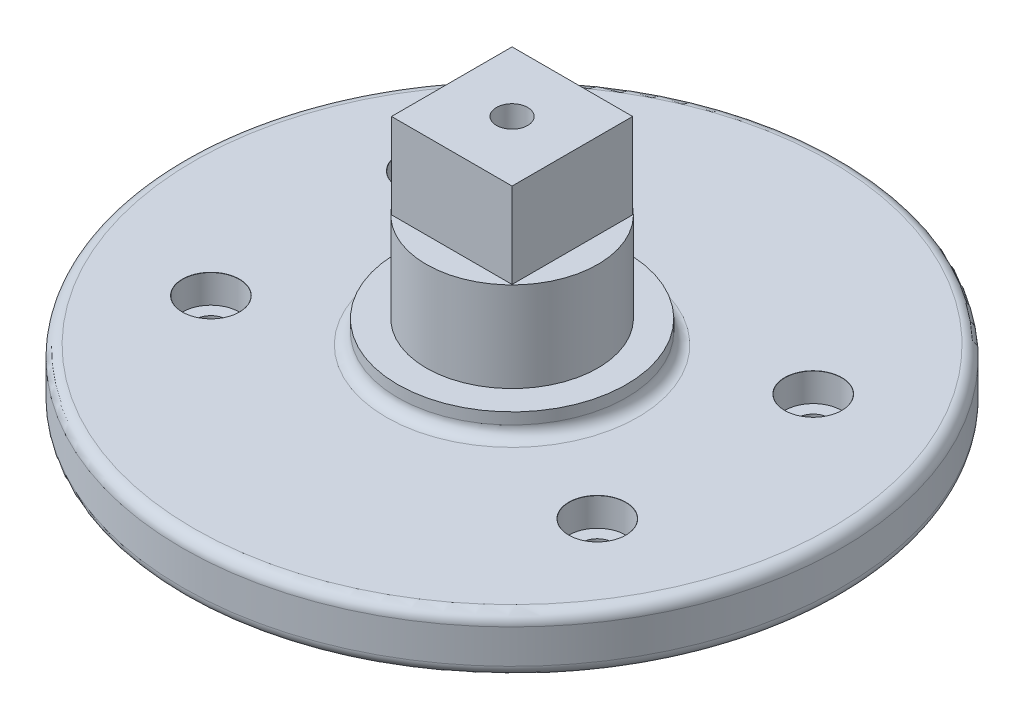
from build123d import *

# Parameters (mm, degrees)
SKETCH1_R                      = 58
BOSS_EXTRUDE1_DEPTH            = 10
CBORE_FOR_M5_SHCS3_AT_2_COUNT  = 2
CBORE_FOR_M5_SHCS3_AT_2_PITCH  = 68
CBORE_FOR_M5_SHCS3_AT_3_COUNT  = 2
CBORE_FOR_M5_SHCS3_AT_3_PITCH  = 38
CBORE_FOR_M5_SHCS3_AT_4_COUNT  = 2
CBORE_FOR_M5_SHCS3_AT_4_PITCH  = 77.897368377
SKETCH5_R                      = 20.125
BOSS_EXTRUDE3_DEPTH            = 4
SKETCH4_R                      = 15.1
BOSS_EXTRUDE2_DEPTH            = 15.8
FILLET1_R                      = 2
FILLET2_R                      = 2
SKETCH7_W                      = 21.213203436
SKETCH7_H                      = 21.213203436
BOSS_EXTRUDE4_DEPTH            = 15
M5_CLEARANCE_HOLE1_D           = 5.5
M5_CLEARANCE_HOLE1_CSINK_D     = 5.55
M5_CLEARANCE_HOLE1_CSINK_ANGLE = 90
CUT_EXTRUDE1_DEPTH             = 3.8


with BuildPart() as part:
    # Sketch1 → Boss-Extrude1 (new body)
    with BuildSketch(Plane(origin=(0, 0, 0), x_dir=(1, 0, 0), z_dir=(0, 1, 0))):
        with Locations(Location((0, 0, 0), (0, 0, 270))):
            Circle(SKETCH1_R)
    extrude(amount=BOSS_EXTRUDE1_DEPTH)

    # Sketch3 → CBORE for M5 SHCS3 (revolve, cut)
    with BuildSketch(Plane(origin=(-34, 10, -19), x_dir=(0, 0, 1), z_dir=(1, 0, 0))):
        Polygon((0, 0), (0, 10), (2.75, 10), (2.75, 5), (5, 5), (5, 0.025), (5.025, 0), align=None)
    cbore_for_m5_shcs3 = revolve(axis=Axis((-34, 16.35, -19), (0, -1, 0)), mode=Mode.SUBTRACT)

    # CBORE for M5 SHCS3 at 2: CBORE for M5 SHCS3 ×2
    with Locations(*[(i * CBORE_FOR_M5_SHCS3_AT_2_PITCH, 0, 0) for i in range(1, CBORE_FOR_M5_SHCS3_AT_2_COUNT)]):
        add(cbore_for_m5_shcs3, mode=Mode.SUBTRACT)

    # CBORE for M5 SHCS3 at 3: CBORE for M5 SHCS3 ×2
    with Locations(*[(0, 0, i * CBORE_FOR_M5_SHCS3_AT_3_PITCH) for i in range(1, CBORE_FOR_M5_SHCS3_AT_3_COUNT)]):
        add(cbore_for_m5_shcs3, mode=Mode.SUBTRACT)

    # CBORE for M5 SHCS3 at 4: CBORE for M5 SHCS3 ×2
    with Locations(*[Vector(0.8729434821372646, 0, 0.48782135766494195) * (i * CBORE_FOR_M5_SHCS3_AT_4_PITCH) for i in range(1, CBORE_FOR_M5_SHCS3_AT_4_COUNT)]):
        add(cbore_for_m5_shcs3, mode=Mode.SUBTRACT)

    # Sketch5 → Boss-Extrude3 (add)
    with BuildSketch(Plane(origin=(0, 10, 0), x_dir=(1, 0, 0), z_dir=(0, 1, 0))):
        with Locations(Location((0, 0, 0), (0, 0, 270))):
            Circle(SKETCH5_R)
    extrude(amount=BOSS_EXTRUDE3_DEPTH)

    # Sketch4 → Boss-Extrude2 (add)
    with BuildSketch(Plane(origin=(0, 14, 0), x_dir=(1, 0, 0), z_dir=(0, 1, 0))):
        with Locations(Location((0, 0, 0), (0, 0, 270))):
            Circle(SKETCH4_R)
    extrude(amount=BOSS_EXTRUDE2_DEPTH)

    # Fillet1
    fillet1_edges = [part.edges().sort_by_distance(p)[0] for p in [
        (0, 0, -58),
        (0, 10, -58),
    ]]
    fillet(fillet1_edges, radius=FILLET1_R)

    # Fillet2
    fillet2_edges = [part.edges().sort_by_distance(p)[0] for p in [
        (0, 10, -20.125),
    ]]
    fillet(fillet2_edges, radius=FILLET2_R)

    # Sketch7 → Boss-Extrude4 (add)
    with BuildSketch(Plane(origin=(0, 29.8, 0), x_dir=(1, 0, 0), z_dir=(0, 1, 0))):
        Rectangle(SKETCH7_W, SKETCH7_H)
    extrude(amount=BOSS_EXTRUDE4_DEPTH)

    # M5 Clearance Hole1 (through all)
    with Locations(Plane(origin=(0, 0, 0), x_dir=(-1, 0, 0), z_dir=(0, -1, 0))):
        with Locations((0, 0)):
            CounterSinkHole(M5_CLEARANCE_HOLE1_D / 2, M5_CLEARANCE_HOLE1_CSINK_D / 2, counter_sink_angle=M5_CLEARANCE_HOLE1_CSINK_ANGLE)

    # Sketch10 → Cut-Extrude1 (cut)
    with BuildSketch(Plane.XZ):
        Polygon((2.367136104, 4.1), (-2.367136104, 4.1), (-4.734272207, 0), (-2.367136104, -4.1), (2.367136104, -4.1), (4.734272207, 0), align=None)
    extrude(amount=-CUT_EXTRUDE1_DEPTH, mode=Mode.SUBTRACT)


solid = part.part
